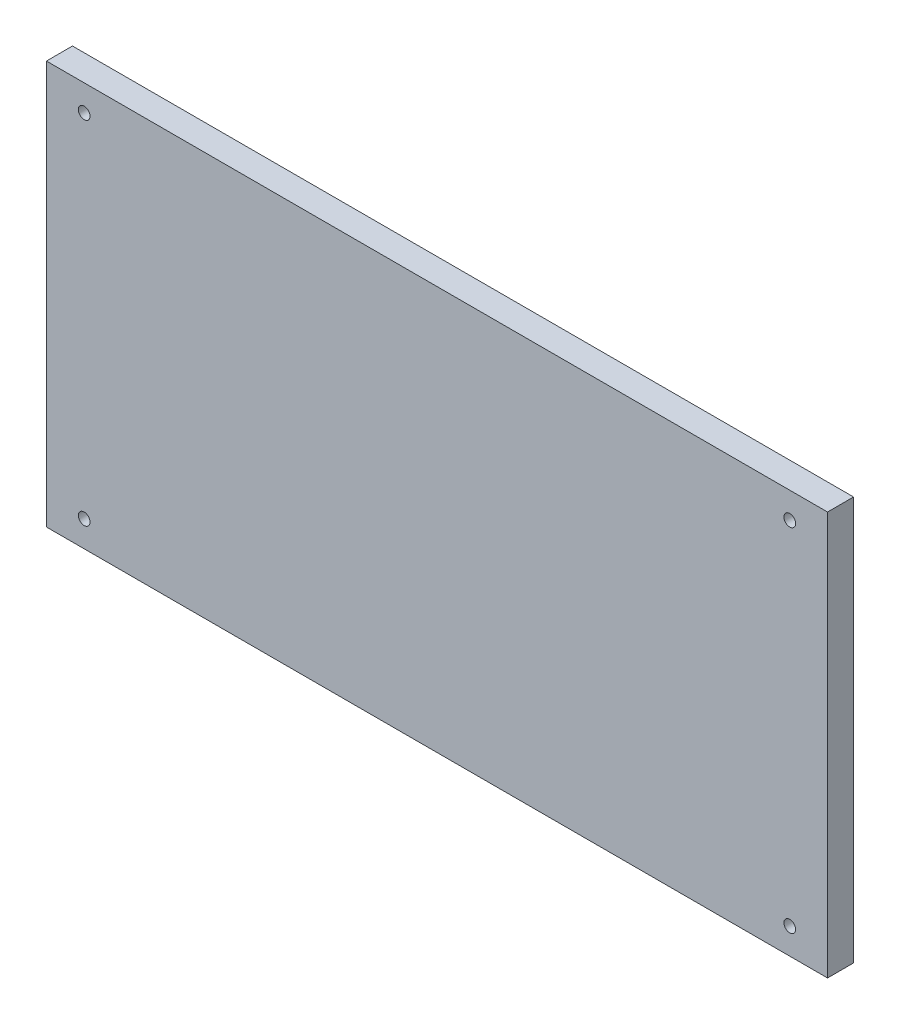
from build123d import *

# Parameters (mm, degrees)
ESQUISSE1_W             = 300
ESQUISSE1_H             = 155
BOSS_EXTRU_1_DEPTH      = 10
ESQUISSE2_R             = 2.25
ENL_V_MAT_EXTRU_1_DEPTH = 10


with BuildPart() as part:
    # Esquisse1 → Boss.-Extru.1 (new body)
    with BuildSketch(Plane.XY):
        with Locations((27.555428531, -35.564516129)):
            Rectangle(ESQUISSE1_W, ESQUISSE1_H)
    extrude(amount=BOSS_EXTRU_1_DEPTH)

    # Esquisse2 → Enlèv. mat.-Extru.1 (cut)
    with BuildSketch(Plane(origin=(0, 0, 0), x_dir=(-1, 0, 0), z_dir=(0, 0, -1))):
        with Locations((-163.055428531, -103.064516129)):
            Circle(ESQUISSE2_R)
        with Locations((-163.055428531, 31.935483871)):
            Circle(ESQUISSE2_R)
        with Locations((107.944571469, 31.935483871)):
            Circle(ESQUISSE2_R)
        with Locations((107.944571469, -103.064516129)):
            Circle(ESQUISSE2_R)
    extrude(amount=-ENL_V_MAT_EXTRU_1_DEPTH, mode=Mode.SUBTRACT)


solid = part.part
